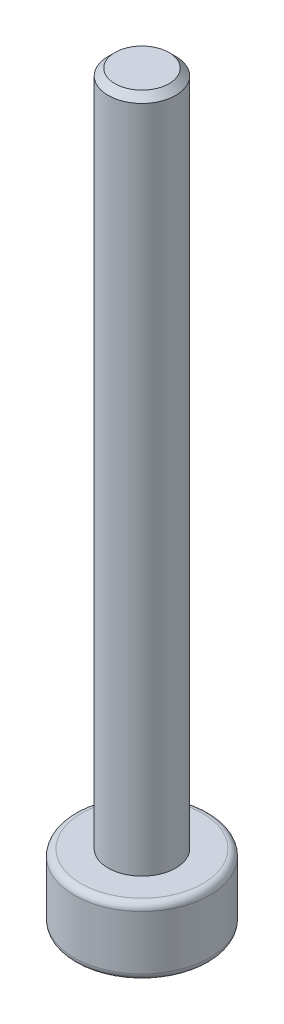
from build123d import *

# Parameters (mm, degrees)
SKETCH_2_R          = 2
EXTRUDE_1_DEPTH     = 2
SKETCH_3_R          = 1
EXTRUDE_2_DEPTH     = 20
FILLET_1_R          = 0.2
SKETCH_4_R          = 0.765
CUT_EXTRUDE_1_DEPTH = 1.52
CHAMFER_1_SIZE      = 0.1
CHAMFER_2_SIZE      = 0.2


with BuildPart() as part:
    # 草图2 → 凸台-拉伸1 (new body)
    with BuildSketch(Plane(origin=(0, 0, 0), x_dir=(1, 0, 0), z_dir=(0, 1, 0))):
        with Locations(Location((0, 0, 0), (0, 0, 270))):
            Circle(SKETCH_2_R)
    extrude(amount=EXTRUDE_1_DEPTH)

    # 草图3 → 凸台-拉伸2 (add)
    with BuildSketch(Plane(origin=(0, 2, 0), x_dir=(1, 0, 0), z_dir=(0, 1, 0))):
        with Locations(Location((0, 0, 0), (0, 0, 270))):
            Circle(SKETCH_3_R)
    extrude(amount=EXTRUDE_2_DEPTH)

    # 圆角1
    fillet_1_edges = [part.edges().sort_by_distance(p)[0] for p in [
        (0, 0, -2),
        (0, 2, -2),
    ]]
    fillet(fillet_1_edges, radius=FILLET_1_R)

    # 草图4 → 切除-拉伸1 (cut)
    with BuildSketch(Plane.XZ):
        with Locations(Location((0, 0, 0), (0, 0, 270))):
            Circle(SKETCH_4_R)
    extrude(amount=-CUT_EXTRUDE_1_DEPTH, mode=Mode.SUBTRACT)

    # 倒角1
    chamfer_1_edges = [part.edges().sort_by_distance(p)[0] for p in [
        (0, 0, 0.765),
    ]]
    chamfer(chamfer_1_edges, length=CHAMFER_1_SIZE)

    # 倒角2
    chamfer_2_edges = [part.edges().sort_by_distance(p)[0] for p in [
        (0, 22, -1),
    ]]
    chamfer(chamfer_2_edges, length=CHAMFER_2_SIZE)


solid = part.part
